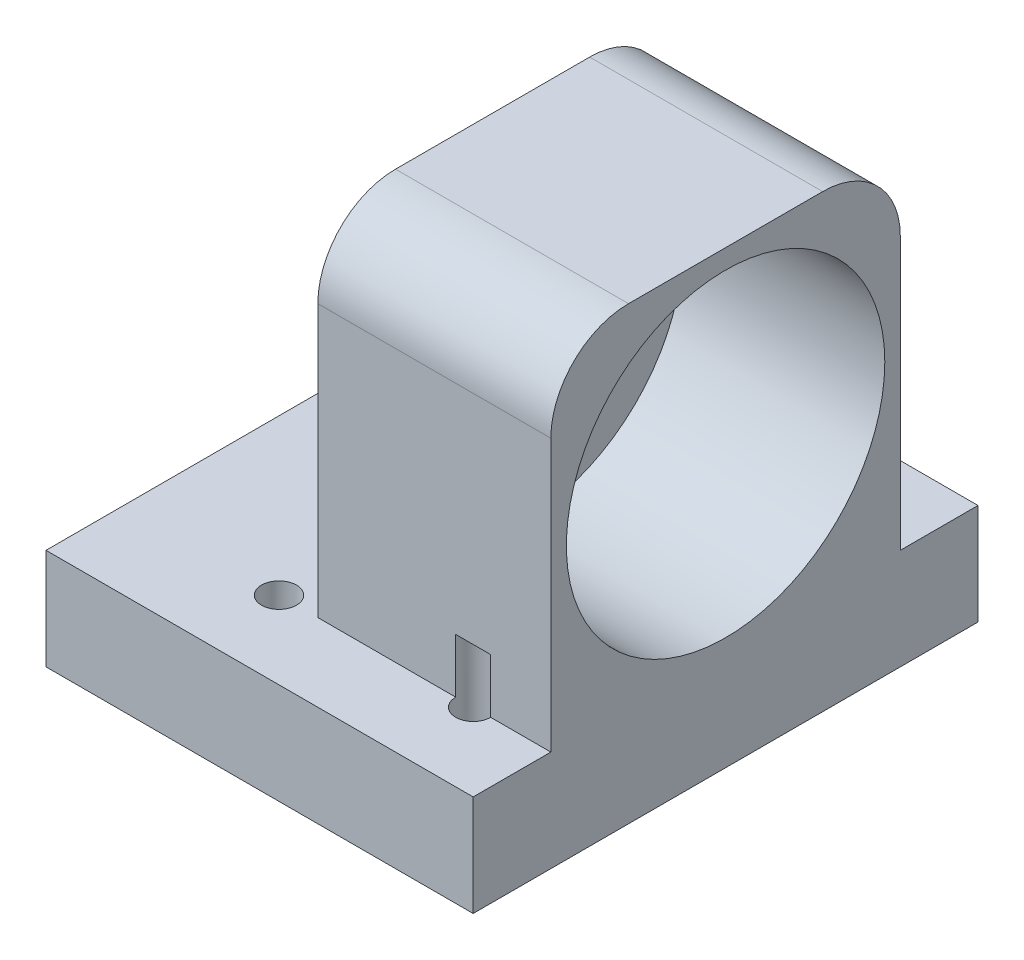
from build123d import *

# Parameters (mm, degrees)
SKETCH1_W           = 55
SKETCH1_H           = 65
BOSS_EXTRUDE1_DEPTH = 13
SKETCH2_W           = 30
SKETCH2_H           = 45
BOSS_EXTRUDE2_DEPTH = 50
SKETCH5_R           = 20.5
CUT_EXTRUDE1_DEPTH  = 26
SKETCH7_R           = 7
CUT_EXTRUDE2_DEPTH  = 20
SKETCH8_R           = 2.25
CUT_EXTRUDE3_DEPTH  = 20
FILLET1_R           = 10
SKETCH9_W           = 30
SKETCH9_H           = 45
CUT_EXTRUDE4_DEPTH  = 5
FILLET4_R           = 10
FILLET5_R           = 10


with BuildPart() as part:
    # Sketch1 → Boss-Extrude1 (new body)
    with BuildSketch(Plane(origin=(0, 0, 0), x_dir=(1, 0, 0), z_dir=(0, 1, 0))):
        with Locations((-5, 0)):
            Rectangle(SKETCH1_W, SKETCH1_H)
    extrude(amount=BOSS_EXTRUDE1_DEPTH)

    # Sketch2 → Boss-Extrude2 (add)
    with BuildSketch(Plane(origin=(0, 13, 0), x_dir=(1, 0, 0), z_dir=(0, 1, 0))):
        with Locations((7.5, 0)):
            Rectangle(SKETCH2_W, SKETCH2_H)
    extrude(amount=BOSS_EXTRUDE2_DEPTH)

    # Sketch5 → Cut-Extrude1 (cut)
    with BuildSketch(Plane(origin=(22.5, 0, 0), x_dir=(0, 0, -1), z_dir=(1, 0, 0))):
        with Locations((0, 35)):
            Circle(SKETCH5_R)
    extrude(amount=-CUT_EXTRUDE1_DEPTH, mode=Mode.SUBTRACT)

    # Sketch7 → Cut-Extrude2 (cut)
    with BuildSketch(Plane(origin=(-3.5, 0, 0), x_dir=(0, 0, -1), z_dir=(1, 0, 0))):
        with Locations((0, 35)):
            Circle(SKETCH7_R)
    extrude(amount=-CUT_EXTRUDE2_DEPTH, mode=Mode.SUBTRACT)

    # Sketch8 → Cut-Extrude3 (cut)
    with BuildSketch(Plane(origin=(0, 0, 0), x_dir=(-1, 0, 0), z_dir=(0, -1, 0))):
        with Locations(Location((12.5, -22.5, 0), (0, 0, 90))):
            Circle(SKETCH8_R)
        with Locations(Location((12.5, 22.5, 0), (0, 0, 90))):
            Circle(SKETCH8_R)
        with Locations(Location((-12.5, 22.5, 0), (0, 0, 90))):
            Circle(SKETCH8_R)
        with Locations(Location((-12.5, -22.5, 0), (0, 0, 90))):
            Circle(SKETCH8_R)
    extrude(amount=-CUT_EXTRUDE3_DEPTH, mode=Mode.SUBTRACT)

    # Fillet1
    fillet1_edges = [part.edges().sort_by_distance(p)[0] for p in [
        (-32.5, 6.5, -32.5),
    ]]
    fillet(fillet1_edges, radius=FILLET1_R)

    # Sketch9 → Cut-Extrude4 (cut)
    with BuildSketch(Plane(origin=(0, 63, 0), x_dir=(1, 0, 0), z_dir=(0, 1, 0))):
        with Locations((7.5, 0)):
            Rectangle(SKETCH9_W, SKETCH9_H)
    extrude(amount=-CUT_EXTRUDE4_DEPTH, mode=Mode.SUBTRACT)

    # Fillet4
    fillet4_edges = [part.edges().sort_by_distance(p)[0] for p in [
        (7.5, 58, 22.5),
    ]]
    fillet(fillet4_edges, radius=FILLET4_R)

    # Fillet5
    fillet5_edges = [part.edges().sort_by_distance(p)[0] for p in [
        (7.5, 58, -22.5),
    ]]
    fillet(fillet5_edges, radius=FILLET5_R)


solid = part.part
